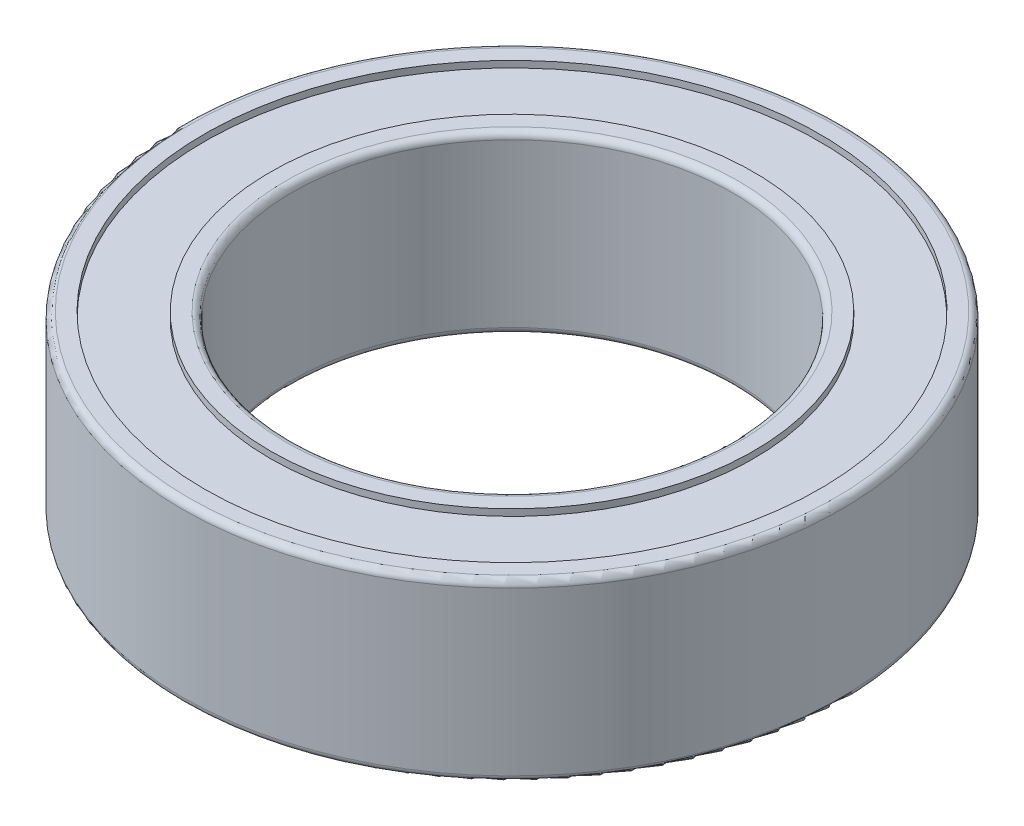
from build123d import *


with BuildPart() as part:
    # Esquisse1 → Révolution1 (revolve)
    with BuildSketch(Plane(origin=(0, 0, 0), x_dir=(-1, 0, 0), z_dir=(0, 0, -1)), mode=Mode.PRIVATE) as r_volution1_sk:
        with BuildLine():
            Line((-5, -1.85), (-5, 1.85))
            ThreePointArc((-5, 1.85), (-5.043933983, 1.956066017), (-5.15, 2))
            Line((-5.15, 2), (-5.5, 2))
            Line((-5.5, 2), (-5.5, 1.85))
            Line((-5.5, 1.85), (-7, 1.85))
            Line((-7, 1.85), (-7, 2))
            Line((-7, 2), (-7.35, 2))
            ThreePointArc((-7.35, 2), (-7.456066017, 1.956066017), (-7.5, 1.85))
            Line((-7.5, 1.85), (-7.5, -1.85))
            ThreePointArc((-7.5, -1.85), (-7.456066017, -1.956066017), (-7.35, -2))
            Line((-7.35, -2), (-7, -2))
            Line((-7, -2), (-7, -1.85))
            Line((-7, -1.85), (-5.5, -1.85))
            Line((-5.5, -1.85), (-5.5, -2))
            Line((-5.5, -2), (-5.15, -2))
            ThreePointArc((-5.15, -2), (-5.043933983, -1.956066017), (-5, -1.85))
        make_face()
    revolve(r_volution1_sk.sketch.rotate(Axis((0, -2.003031087, 0), (0, 1, 0)), 270), axis=Axis((0, -2.003031087, 0), (0, 1, 0)))


solid = part.part
